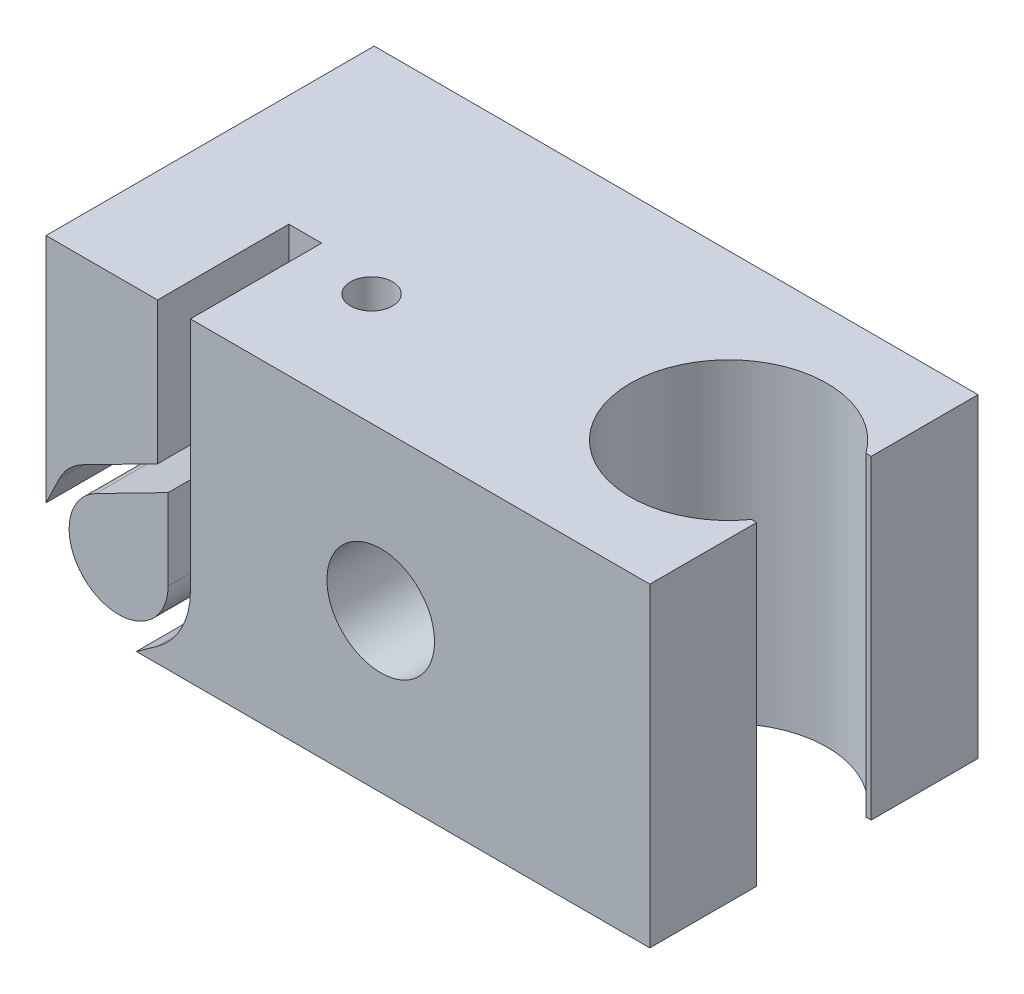
from build123d import *

# Parameters (mm, degrees)
SKETCH1_W            = 22.5
SKETCH1_H            = 25
SKETCH1_R            = 7.5
BOSS_EXTRUDE1_DEPTH  = 24
CUT_EXTRUDE4_DEPTH   = 30.807717122
SKETCH7_W            = 10
SKETCH7_H            = 25
BOSS_EXTRUDE2_DEPTH  = 24
SKETCH8_R            = 4.1
CUT_EXTRUDE5_DEPTH   = 48
SKETCH135_W          = 19.5
SKETCH135_H          = 24
BOSS_EXTRUDE66_DEPTH = 15
BOSS_EXTRUDE67_DEPTH = 10
SKETCH137_W          = 6.5
SKETCH137_H          = 24
CUT_EXTRUDE6_DEPTH   = 5.3
SKETCH138_W          = 6.5
SKETCH138_H          = 1.8
BOSS_EXTRUDE68_DEPTH = 24
SKETCH139_W          = 6.5
SKETCH139_H          = 13.5
SKETCH139_R          = 1.6
BOSS_EXTRUDE69_DEPTH = 5


with BuildPart() as part:
    # Sketch1 → Boss-Extrude1 (new body)
    with BuildSketch(Plane(origin=(0, 0, 0), x_dir=(1, 0, 0), z_dir=(0, 1, 0))):
        with Locations((1.25, 0)):
            Rectangle(SKETCH1_W, SKETCH1_H)
        with Locations(Location((0, 0, 0), (0, 0, 270))):
            Circle(SKETCH1_R, mode=Mode.SUBTRACT)
    extrude(amount=BOSS_EXTRUDE1_DEPTH)

    # Sketch5 → Cut-Extrude4 (cut, through all)
    with BuildSketch(Plane.XZ):
        Polygon((12.5, 12.5), (6.5, 12.5), (6.5, 4.363484846), (6.1, 4.363484846), (6.1, -4.363484846), (6.5, -4.363484846), (6.5, -12.5), (12.5, -12.5), align=None)
    extrude(amount=-CUT_EXTRUDE4_DEPTH, mode=Mode.SUBTRACT)

    # Sketch7 → Boss-Extrude2 (add)
    with BuildSketch(Plane.XZ):
        with Locations((-15, 0)):
            Rectangle(SKETCH7_W, SKETCH7_H)
    extrude(amount=-BOSS_EXTRUDE2_DEPTH)

    # Sketch8 → Cut-Extrude5 (cut)
    with BuildSketch(Plane.XY.offset(12.5)):
        with Locations((-14, 12)):
            Circle(SKETCH8_R)
    extrude(amount=-CUT_EXTRUDE5_DEPTH, mode=Mode.SUBTRACT)

    # Sketch135 → Boss-Extrude66 (add)
    with BuildSketch(Plane(origin=(0, 0, -12.5), x_dir=(-1, 0, 0), z_dir=(0, 0, -1))):
        with Locations((29.75, 12)):
            Rectangle(SKETCH135_W, SKETCH135_H)
    extrude(amount=-BOSS_EXTRUDE66_DEPTH)

    # Sketch136 → Boss-Extrude67 (add)
    with BuildSketch(Plane.XY.offset(2.5)):
        with BuildLine():
            Line((-26.5, 0), (-30.65, 0))
            Line((-30.65, 0), (-32.618157491, 0))
            Line((-32.618157491, 0), (-31.015837104, 1.142896884))
            ThreePointArc((-31.015837104, 1.142896884), (-29.165912572, 3.280355677), (-28.5, 6.027629109))
            Line((-28.5, 6.027629109), (-28.5, 24))
            Line((-28.5, 24), (-26.5, 24))
            Line((-26.5, 24), (-26.5, 0))
        make_face()
        with BuildLine():
            Line((-31, 24), (-39.5, 24))
            Line((-39.5, 24), (-39.5, 8.68))
            Line((-39.5, 8.68), (-39.5, 6.362551494))
            Line((-39.5, 6.362551494), (-38.492686138, 8.449627525))
            ThreePointArc((-38.492686138, 8.449627525), (-37.750547948, 9.507229314), (-36.71, 10.273095232))
            Line((-36.71, 10.273095232), (-31, 13.19))
            Line((-31, 13.19), (-31, 24))
        make_face()
        with BuildLine():
            Line((-30.2, 5.530404879), (-30.2, 11.689701848))
            Line((-30.2, 11.689701848), (-35.685050881, 8.887710417))
            ThreePointArc((-35.685050881, 8.887710417), (-35.938141024, 2.314923436), (-30.2, 5.530404879))
        make_face()
    extrude(amount=BOSS_EXTRUDE67_DEPTH)

    # Sketch137 → Cut-Extrude6 (cut)
    with BuildSketch(Plane.XY.offset(2.5)):
        with Locations((-23.25, 12)):
            Rectangle(SKETCH137_W, SKETCH137_H)
    extrude(amount=-CUT_EXTRUDE6_DEPTH, mode=Mode.SUBTRACT)

    # Sketch138 → Boss-Extrude68 (add)
    with BuildSketch(Plane.XZ):
        with Locations((-23.25, 11.6)):
            Rectangle(SKETCH138_W, SKETCH138_H)
    extrude(amount=-BOSS_EXTRUDE68_DEPTH)

    # Sketch139 → Boss-Extrude69 (add)
    with BuildSketch(Plane(origin=(0, 24, 0), x_dir=(1, 0, 0), z_dir=(0, 1, 0))):
        with Locations((-23.25, -3.95)):
            Rectangle(SKETCH139_W, SKETCH139_H)
        with Locations(Location((-23.25, -3.95, 0), (0, 0, 270))):
            Circle(SKETCH139_R, mode=Mode.SUBTRACT)
    extrude(amount=-BOSS_EXTRUDE69_DEPTH)


solid = part.part
